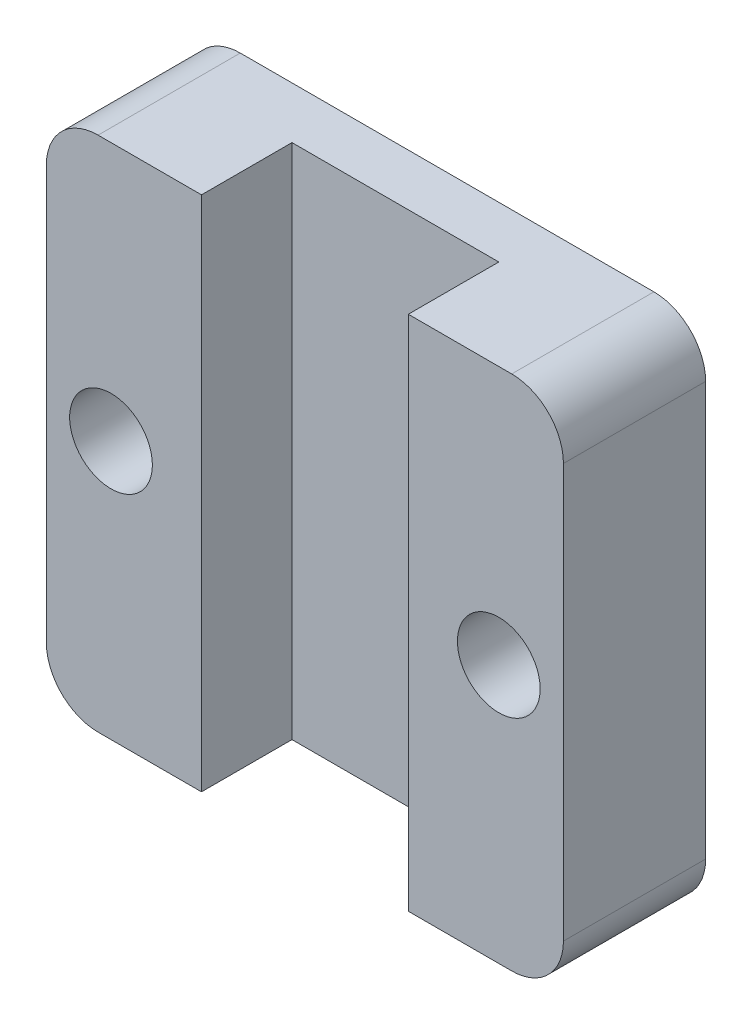
from build123d import *

# Parameters (mm, degrees)
SKETCH1_W           = 20
SKETCH1_H           = 20
BOSS_EXTRUDE1_DEPTH = 5.5
SKETCH2_W           = 8
SKETCH2_H           = 3.5
CUT_EXTRUDE1_DEPTH  = 24.027157879
HOLEWZD1_D          = 3.2
FILLET1_R           = 2


with BuildPart() as part:
    # Sketch1 → Boss-Extrude1 (new body)
    with BuildSketch(Plane(origin=(0, 0, 0), x_dir=(-1, 0, 0), z_dir=(0, 0, -1))):
        Rectangle(SKETCH1_W, SKETCH1_H)
    extrude(amount=-BOSS_EXTRUDE1_DEPTH)

    # Sketch2 → Cut-Extrude1 (cut, through all)
    with BuildSketch(Plane(origin=(0, 10, 0), x_dir=(-1, 0, 0), z_dir=(0, 1, 0))):
        with Locations((0, 3.75)):
            Rectangle(SKETCH2_W, SKETCH2_H)
    extrude(amount=-CUT_EXTRUDE1_DEPTH, mode=Mode.SUBTRACT)

    # HoleWzd1 (through all)
    with Locations(Plane.XY.offset(5.5)):
        with Locations((7.5, 0), (-7.5, 0)):
            Hole(HOLEWZD1_D / 2)

    # Fillet1
    fillet1_edges = [part.edges().sort_by_distance(p)[0] for p in [
        (-10, -10, 2.75),
        (10, -10, 2.75),
        (10, 10, 2.75),
        (-10, 10, 2.75),
    ]]
    fillet(fillet1_edges, radius=FILLET1_R)


solid = part.part
